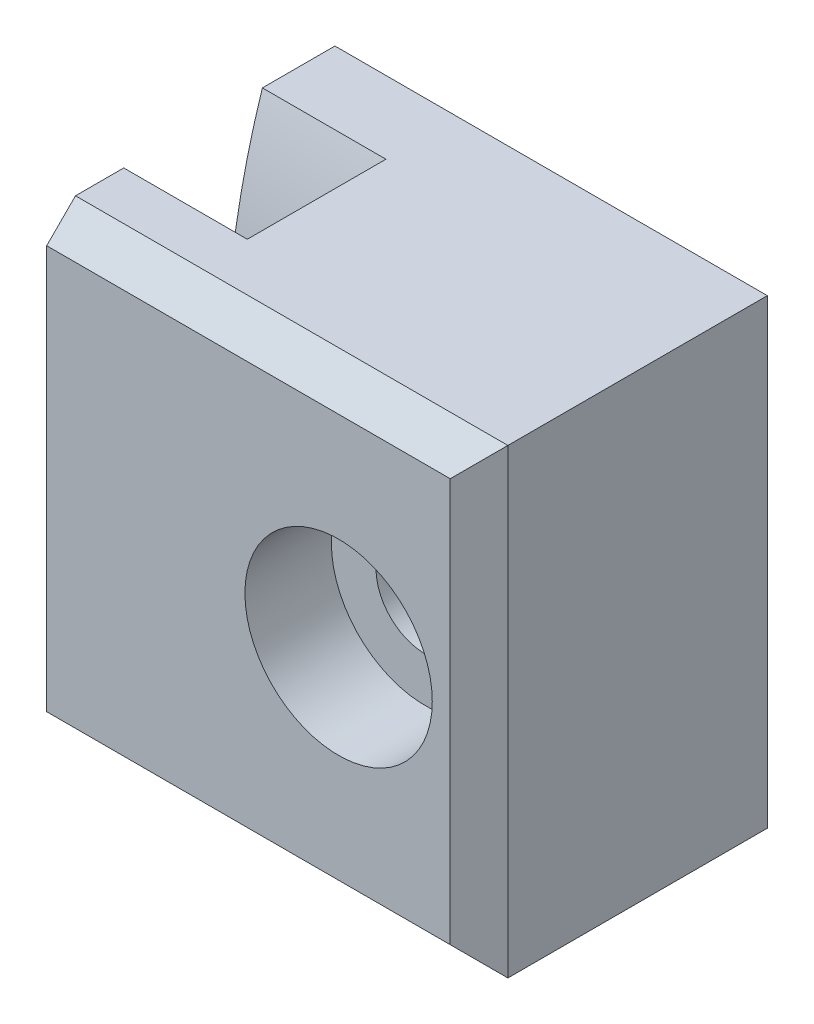
from build123d import *

# Parameters (mm, degrees)
ESQUISSE1_W                                        = 15
ESQUISSE1_H                                        = 16
EXTRUSION1_DEPTH                                   = 10
CHANFREIN1_SIZE                                    = 1
CHAMBRAGE_POUR_VIS_T_TE_HEXAGONALE_M31_D           = 3.4
CHAMBRAGE_POUR_VIS_T_TE_HEXAGONALE_M31_CBORE_D     = 6.5
CHAMBRAGE_POUR_VIS_T_TE_HEXAGONALE_M31_CBORE_DEPTH = 3
ESQUISSE2_W                                        = 5.5288305
ESQUISSE2_H                                        = 4.608549318
ENL_VEMENT_DE_MATI_RE_R_VOLUTION1_ANGLE            = 39
CHANFREIN2_SIZE                                    = 1


with BuildPart() as part:
    # Esquisse1 → Extrusion1 (new body)
    with BuildSketch(Plane.XY):
        with Locations((7.5, 0)):
            Rectangle(ESQUISSE1_W, ESQUISSE1_H)
    extrude(amount=EXTRUSION1_DEPTH)

    # Chanfrein1
    chanfrein1_edges = [part.edges().sort_by_distance(p)[0] for p in [
        (7.5, -8, 10),
        (7.5, 8, 10),
    ]]
    chamfer(chanfrein1_edges, length=CHANFREIN1_SIZE)

    # Chambrage pour vis à tête hexagonale M31 (through all)
    with Locations(Plane(origin=(10.126877496, 0, 10), x_dir=(1, 0, 0), z_dir=(0, 0, 1))):
        with Locations((0, 0)):
            CounterBoreHole(CHAMBRAGE_POUR_VIS_T_TE_HEXAGONALE_M31_D / 2, CHAMBRAGE_POUR_VIS_T_TE_HEXAGONALE_M31_CBORE_D / 2, CHAMBRAGE_POUR_VIS_T_TE_HEXAGONALE_M31_CBORE_DEPTH)

    # Esquisse2 → Enlèvement de matière-Révolution1 (revolve, symmetric, cut)
    with BuildSketch(Plane(origin=(0, 0, 0), x_dir=(1, 0, 0), z_dir=(0, 1, 0))) as enl_vement_de_mati_re_r_volution1_sk:
        with Locations((1.521286307, -6.093228571)):
            Rectangle(ESQUISSE2_W, ESQUISSE2_H)
    revolve(axis=Axis((6.580325396, 0, -22), (1, 0, 0)), revolution_arc=ENL_VEMENT_DE_MATI_RE_R_VOLUTION1_ANGLE / 2, mode=Mode.SUBTRACT)
    revolve(enl_vement_de_mati_re_r_volution1_sk.sketch, axis=Axis((6.580325396, 0, -22), (-1, 0, 0)), revolution_arc=ENL_VEMENT_DE_MATI_RE_R_VOLUTION1_ANGLE / 2, mode=Mode.SUBTRACT)

    # Chanfrein2
    chanfrein2_edges = [part.edges().sort_by_distance(p)[0] for p in [
        (15, 0, 10),
    ]]
    chamfer(chanfrein2_edges, length=CHANFREIN2_SIZE)


solid = part.part
